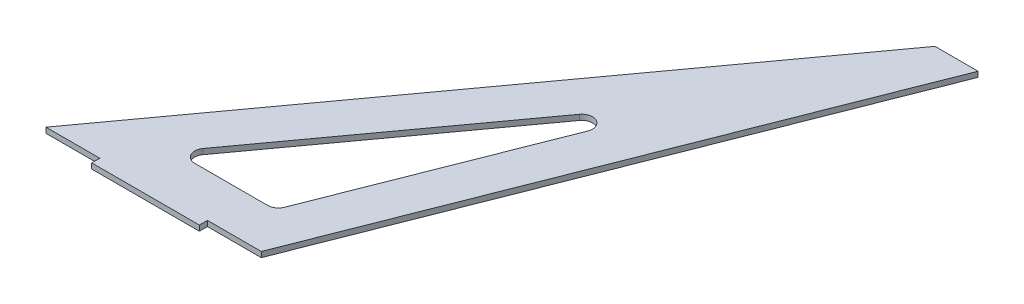
from build123d import *

# Parameters (mm, degrees)
BOSS_EXTRUDE1_DEPTH = 3.175
CUT_EXTRUDE1_DEPTH  = 3.175
FILLET1_R           = 6.35
SKETCH3_W           = 63.5
SKETCH3_H           = 3.175
BOSS_EXTRUDE2_DEPTH = 4.7625


with BuildPart() as part:
    # Sketch1 → Boss-Extrude1 (new body)
    with BuildSketch(Plane(origin=(0, 0, 0), x_dir=(1, 0, 0), z_dir=(0, 1, 0))):
        Polygon((-119.32539, 0), (-246.32539, 0), (-25.4, 303.52288513), (0, 303.52288513), align=None)
    extrude(amount=BOSS_EXTRUDE1_DEPTH)

    # Sketch2 → Cut-Extrude1 (cut)
    with BuildSketch(Plane(origin=(0, 3.175, 0), x_dir=(1, 0, 0), z_dir=(0, 1, 0))):
        Polygon((-136.632122874, 25.4), (-66.411730064, 204.016606412), (-196.421509772, 25.4), align=None)
    extrude(amount=-CUT_EXTRUDE1_DEPTH, mode=Mode.SUBTRACT)

    # Fillet1
    fillet1_edges = [part.edges().sort_by_distance(p)[0] for p in [
        (-136.632122874, 1.5875, -25.4),
        (-196.421509772, 1.5875, -25.4),
        (-66.411730064, 1.5875, -204.016606412),
    ]]
    fillet(fillet1_edges, radius=FILLET1_R)

    # Sketch3 → Boss-Extrude2 (add)
    with BuildSketch(Plane.XY):
        with Locations((-182.82539, 1.5875)):
            Rectangle(SKETCH3_W, SKETCH3_H)
    extrude(amount=BOSS_EXTRUDE2_DEPTH)


solid = part.part
